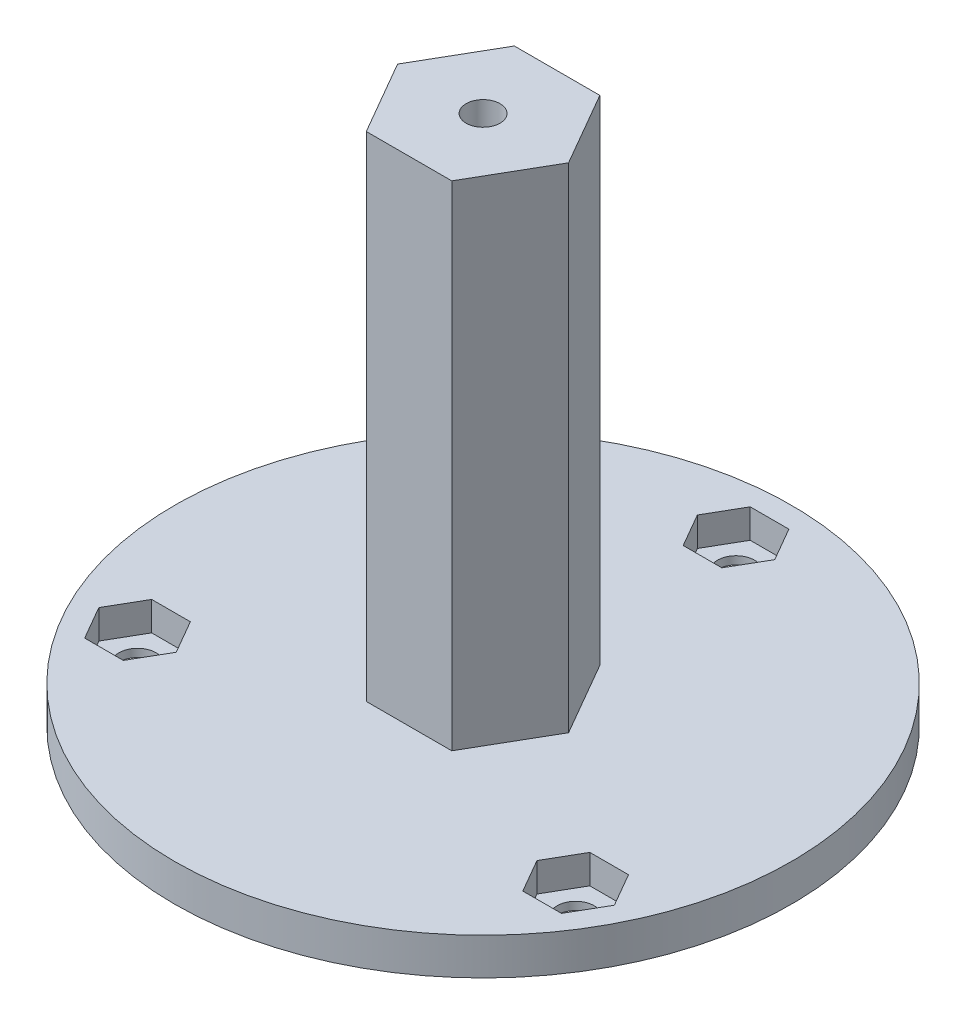
from build123d import *

# Parameters (mm, degrees)
SKETCH1_R           = 25
SKETCH1_R_2         = 1.5
BOSS_EXTRUDE1_DEPTH = 3
BOSS_EXTRUDE2_DEPTH = 40
SKETCH4_R           = 1.375
CUT_EXTRUDE1_DEPTH  = 7.5
CUT_EXTRUDE2_DEPTH  = 2.35


with BuildPart() as part:
    # Sketch1 → Boss-Extrude1 (new body)
    with BuildSketch(Plane(origin=(0, 0, 0), x_dir=(1, 0, 0), z_dir=(0, 1, 0))):
        with Locations(Location((0, 0, 0), (0, 0, 270))):
            Circle(SKETCH1_R)
        with Locations(Location((0, 20.5, 0), (0, 0, 270))):
            Circle(SKETCH1_R_2, mode=Mode.SUBTRACT)
        with Locations(Location((17.753520778, -10.25, 0), (0, 0, 270))):
            Circle(SKETCH1_R_2, mode=Mode.SUBTRACT)
        with Locations(Location((-17.753520778, -10.25, 0), (0, 0, 270))):
            Circle(SKETCH1_R_2, mode=Mode.SUBTRACT)
    extrude(amount=BOSS_EXTRUDE1_DEPTH)

    # Sketch3 → Boss-Extrude2 (add)
    with BuildSketch(Plane(origin=(0, 3, 0), x_dir=(1, 0, 0), z_dir=(0, 1, 0))):
        Polygon((-6.92820323, 0), (-3.464101615, -6), (3.464101615, -6), (6.92820323, 0), (3.464101615, 6), (-3.464101615, 6), align=None)
    extrude(amount=BOSS_EXTRUDE2_DEPTH)

    # Sketch4 → Cut-Extrude1 (cut)
    with BuildSketch(Plane(origin=(0, 43, 0), x_dir=(1, 0, 0), z_dir=(0, 1, 0))):
        with Locations(Location((0, 0, 0), (0, 0, 270))):
            Circle(SKETCH4_R)
    extrude(amount=-CUT_EXTRUDE1_DEPTH, mode=Mode.SUBTRACT)

    # Sketch5 → Cut-Extrude2 (cut)
    with BuildSketch(Plane(origin=(0, 3, 0), x_dir=(1, 0, 0), z_dir=(0, 1, 0))):
        Polygon((1.567505981, 23.215), (-1.567505981, 23.215), (-3.135011962, 20.5), (-1.567505981, 17.785), (1.567505981, 17.785), (3.135011962, 20.5), align=None)
        Polygon((19.321026758, -12.965), (20.888532739, -10.25), (19.321026758, -7.535), (16.186014797, -7.535), (14.618508816, -10.25), (16.186014797, -12.965), align=None)
        Polygon((-20.888532739, -10.25), (-19.321026758, -12.965), (-16.186014797, -12.965), (-14.618508816, -10.25), (-16.186014797, -7.535), (-19.321026758, -7.535), align=None)
    extrude(amount=-CUT_EXTRUDE2_DEPTH, mode=Mode.SUBTRACT)


solid = part.part
